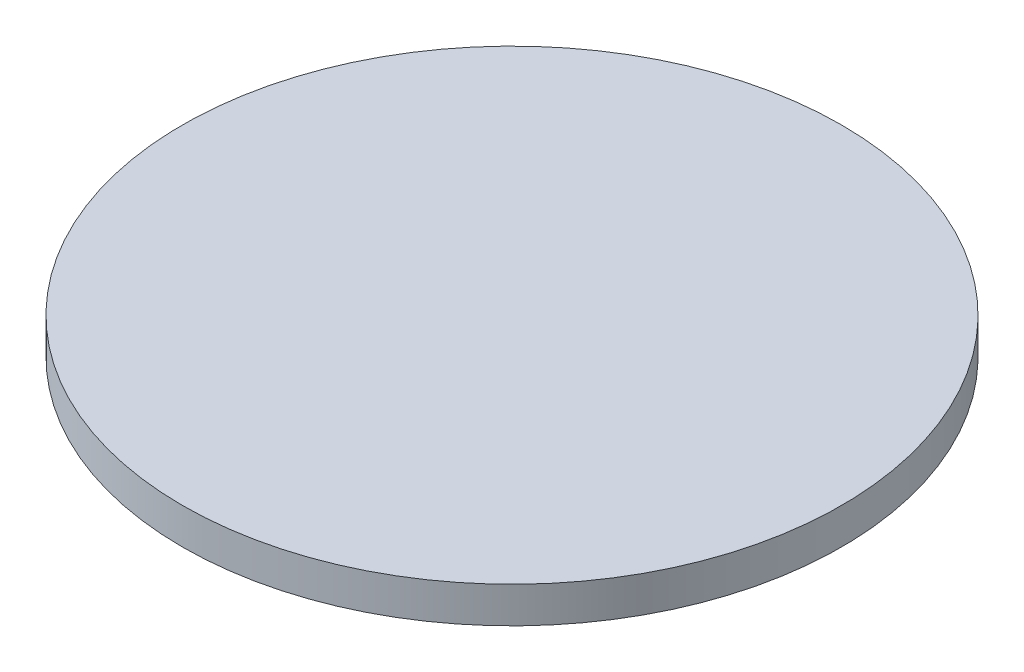
from build123d import *

# Parameters (mm, degrees)
SKETCH1_R           = 64
BOSS_EXTRUDE1_DEPTH = 7


with BuildPart() as part:
    # Sketch1 → Boss-Extrude1 (new body)
    with BuildSketch(Plane(origin=(0, 0, 0), x_dir=(1, 0, 0), z_dir=(0, 1, 0))):
        with Locations(Location((0, 0, 0), (0, 0, 270))):
            Circle(SKETCH1_R)
    extrude(amount=BOSS_EXTRUDE1_DEPTH)


solid = part.part
